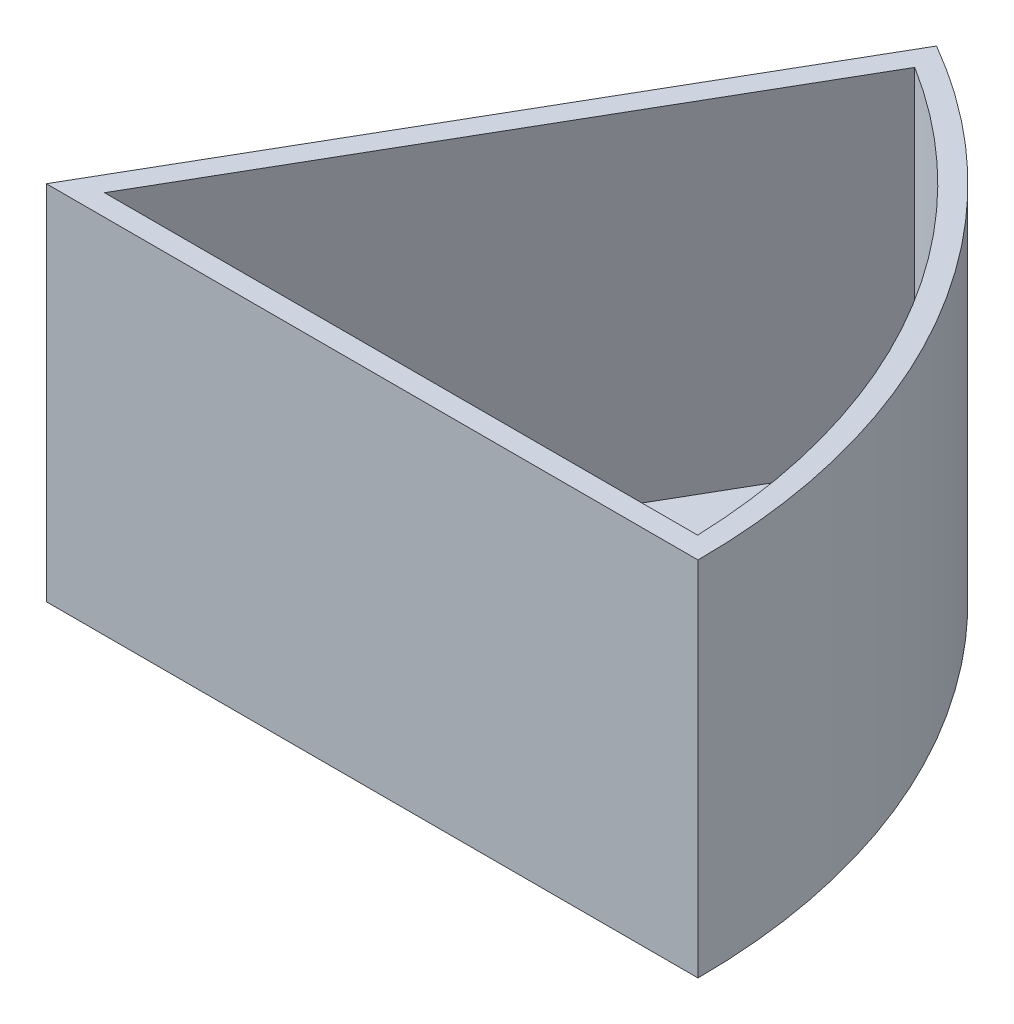
from build123d import *

# Parameters (mm, degrees)
EXTRUDE_1_DEPTH   = 5
EXTRUDE_1_2_DEPTH = 80


with BuildPart() as part:
    # 草图1 → Extrude 1 (new body)
    with BuildSketch(Plane(origin=(0, 0, 0), x_dir=(1, 0, 0), z_dir=(0, 1, 0))):
        with BuildLine():
            Line((0, 0), (153, 0))
            ThreePointArc((153, 0), (132.501886779, 76.5), (76.5, 132.501886779))
            Line((76.5, 132.501886779), (0, 0))
        make_face()
    extrude(amount=EXTRUDE_1_DEPTH)

    # 草图2 → Extrude 1 2 (add)
    with BuildSketch(Plane(origin=(0, 5, 0), x_dir=(1, 0, 0), z_dir=(0, 1, 0))):
        with BuildLine():
            Line((76.5, 132.501886779), (0, 0))
            Line((0, 0), (153, 0))
            ThreePointArc((153, 0), (132.501886779, 76.5), (76.5, 132.501886779))
        make_face()
        with BuildLine():
            Line((78.287885233, 125.59859484), (8.660254038, 5))
            Line((8.660254038, 5), (147.915516427, 5))
            ThreePointArc((147.915516427, 5), (128.17175976, 74), (78.287885233, 125.59859484))
        make_face(mode=Mode.SUBTRACT)
    extrude(amount=EXTRUDE_1_2_DEPTH)


solid = part.part
